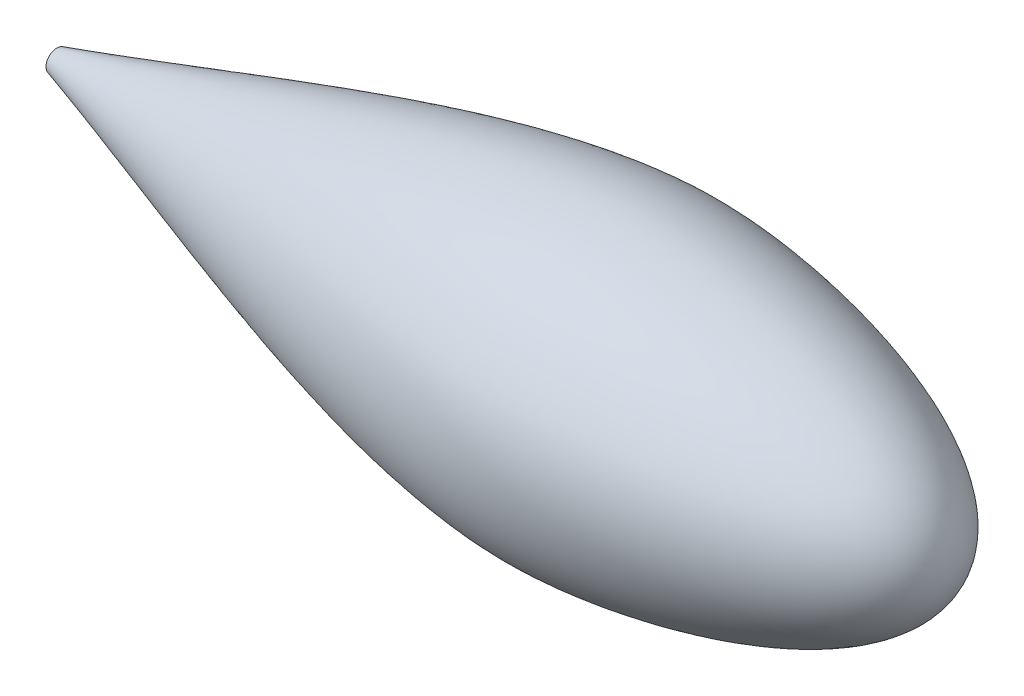
from build123d import *

# Parameters (mm, degrees)
ESQUISSE2_W             = 41.670907092
ESQUISSE2_H             = 35.554076694
ENL_V_MAT_EXTRU_1_DEPTH = 56


with BuildPart() as part:
    # Esquisse1 → Révolution1 (revolve)
    with BuildSketch(Plane(origin=(0, 0, 0), x_dir=(1, 0, 0), z_dir=(0, 1, 0))):
        with BuildLine():
            Line((-250, 0), (0, 0))
            add(Edge.make_bspline(
                [(0, 0), (0, 24.779663363), (-64.464810782, 41.302024754), (-140.894240353, 38.293217904), (-203.385688688, 13.124275478), (-250, 0)],
                knots=[0, 0, 0, 0, 0.334423512, 0.434423512, 1, 1, 1, 1], degree=3))
        make_face()
    revolve(axis=Axis((0, 0, 0), (1, 0, 0)))

    # Esquisse2 → Enlèv. mat.-Extru.1 (cut)
    with BuildSketch(Plane(origin=(-240, 0, 0), x_dir=(0, 0, -1), z_dir=(1, 0, 0))):
        Rectangle(ESQUISSE2_W, ESQUISSE2_H)
    extrude(amount=-ENL_V_MAT_EXTRU_1_DEPTH, mode=Mode.SUBTRACT)


solid = part.part
